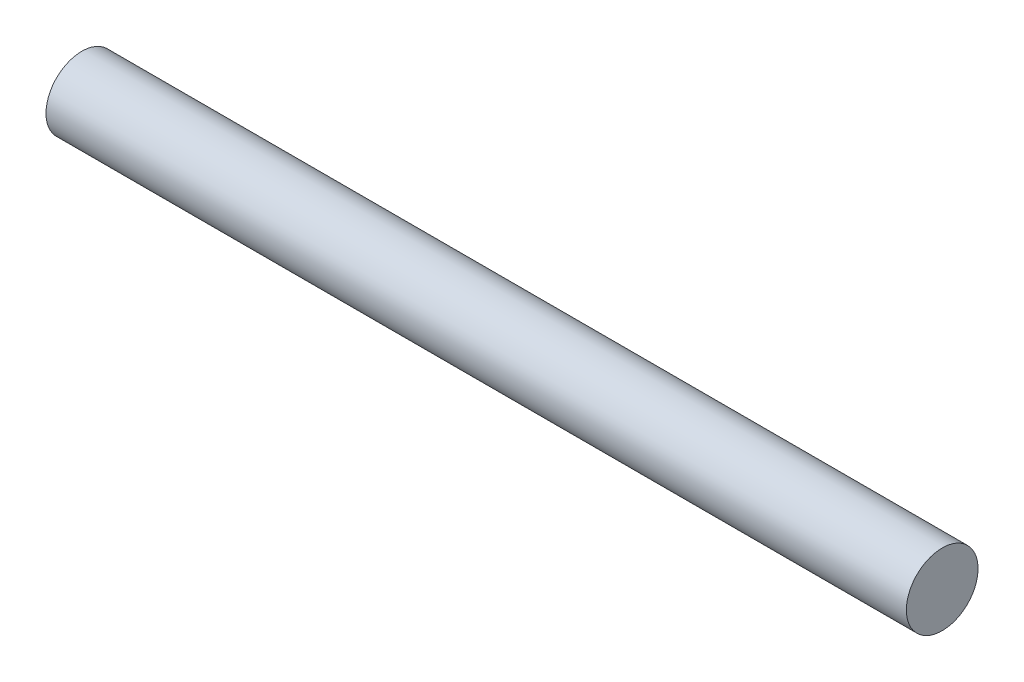
from build123d import *

# Parameters (mm, degrees)
SKETCH_1_R      = 6.35
EXTRUDE_1_DEPTH = 152.4


with BuildPart() as part:
    # 草图1 → 凸台-拉伸1 (new body)
    with BuildSketch(Plane(origin=(0, 0, 0), x_dir=(0, 0, -1), z_dir=(1, 0, 0))):
        with Locations(Location((0, 0, 0), (0, 0, 180))):
            Circle(SKETCH_1_R)
    extrude(amount=EXTRUDE_1_DEPTH)


solid = part.part
